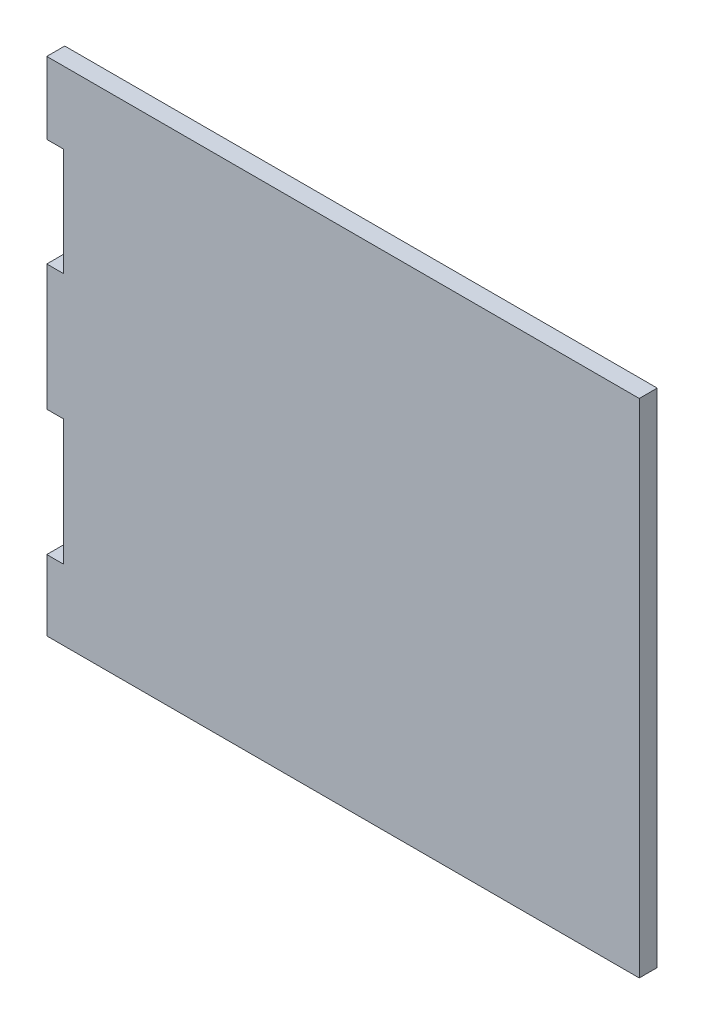
from build123d import *

# Parameters (mm, degrees)
BOSS_EXTRUDE1_DEPTH = 6.35


with BuildPart() as part:
    # Model → Boss-Extrude1 (new body)
    with BuildSketch(Plane.XY):
        Polygon((104.434, 94.6585), (-104.8687, 94.6585), (-104.8687, 69.2585), (-99.0122, 69.2585), (-99.0122, 31.1585), (-104.8687, 31.1585), (-104.8687, -13.2915), (-99.0122, -13.2915), (-99.0122, -57.7414), (-104.8687, -57.7414), (-104.8687, -82.6482), (104.434, -82.6482), align=None)
    extrude(amount=BOSS_EXTRUDE1_DEPTH)


solid = part.part
